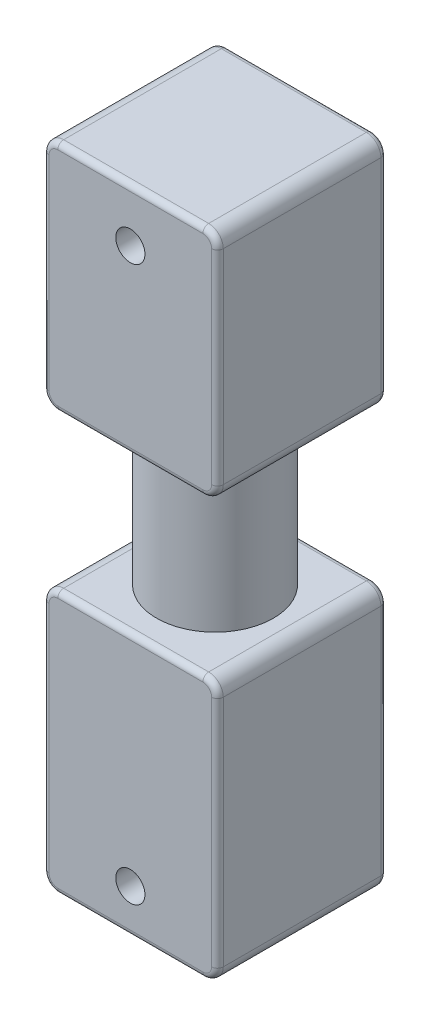
from build123d import *

# Parameters (mm, degrees)
BOSS_EXTRUDE1_DEPTH   = 29
BOSS_EXTRUDE1_2_DEPTH = 29
FILLET1_R             = 1
FILLET2_R             = 1
SKETCH3_R             = 10
BOSS_EXTRUDE2_DEPTH   = 26.527316462
SKETCH4_R             = 2.5
CUT_EXTRUDE4_DEPTH    = 112.4075373


with BuildPart() as part:
    # Sketch1 → Boss-Extrude1 (new body)
    with BuildSketch(Plane.XY):
        with BuildLine():
            Line((-12.418786495, 106.527316462), (12.418786495, 106.527316462))
            ThreePointArc((12.418786495, 106.527316462), (14.186553448, 105.795083415), (14.918786495, 104.027316462))
            Line((14.918786495, 104.027316462), (14.918786495, 69.027316462))
            ThreePointArc((14.918786495, 69.027316462), (14.186553448, 67.259549509), (12.418786495, 66.527316462))
            Line((12.418786495, 66.527316462), (7.418786495, 66.527316462))
            Line((7.418786495, 66.527316462), (-7.418786495, 66.527316462))
            Line((-7.418786495, 66.527316462), (-12.418786495, 66.527316462))
            ThreePointArc((-12.418786495, 66.527316462), (-14.186553448, 67.259549509), (-14.918786495, 69.027316462))
            Line((-14.918786495, 69.027316462), (-14.918786495, 104.027316462))
            ThreePointArc((-14.918786495, 104.027316462), (-14.186553448, 105.795083415), (-12.418786495, 106.527316462))
        make_face()
    extrude(amount=BOSS_EXTRUDE1_DEPTH)

    # Fillet2
    fillet2_edges = [part.edges().sort_by_distance(p)[0] for p in [
        (14.186553448, 105.795083415, 0),
        (0, 106.527316462, 0),
        (-14.186553448, 105.795083415, 0),
        (-14.918786495, 86.527316462, 0),
        (-14.186553448, 67.259549509, 0),
        (0, 66.527316462, 0),
        (14.186553448, 67.259549509, 0),
        (14.918786495, 86.527316462, 0),
        (14.186553448, 105.795083415, 29),
        (0, 106.527316462, 29),
        (-14.186553448, 105.795083415, 29),
        (-14.918786495, 86.527316462, 29),
        (-14.186553448, 67.259549509, 29),
        (0, 66.527316462, 29),
        (14.186553448, 67.259549509, 29),
        (14.918786495, 86.527316462, 29),
    ]]
    fillet(fillet2_edges, radius=FILLET2_R)



with BuildPart() as body_2:
    # Sketch1 → Boss-Extrude1 2 (new body)
    with BuildSketch(Plane.XY):
        with BuildLine():
            Line((7.418786495, 40), (12.418786495, 40))
            ThreePointArc((12.418786495, 40), (14.186553448, 39.267766953), (14.918786495, 37.5))
            Line((14.918786495, 37.5), (14.918786495, -2.5))
            ThreePointArc((14.918786495, -2.5), (14.186553448, -4.267766953), (12.418786495, -5))
            Line((12.418786495, -5), (-12.418786495, -5))
            ThreePointArc((-12.418786495, -5), (-14.186553448, -4.267766953), (-14.918786495, -2.5))
            Line((-14.918786495, -2.5), (-14.918786495, 37.5))
            ThreePointArc((-14.918786495, 37.5), (-14.186553448, 39.267766953), (-12.418786495, 40))
            Line((-12.418786495, 40), (-7.418786495, 40))
            Line((-7.418786495, 40), (7.418786495, 40))
        make_face()
    extrude(amount=BOSS_EXTRUDE1_2_DEPTH)

    # Fillet1
    fillet1_edges = [body_2.edges().sort_by_distance(p)[0] for p in [
        (-14.918786495, 17.5, 0),
        (-14.186553448, 39.267766953, 0),
        (0, 40, 0),
        (14.186553448, 39.267766953, 0),
        (14.918786495, 17.5, 0),
        (14.186553448, -4.267766953, 29),
        (14.186553448, -4.267766953, 0),
        (0, -5, 0),
        (-14.186553448, -4.267766953, 0),
        (14.918786495, 17.5, 29),
        (14.186553448, 39.267766953, 29),
        (0, 40, 29),
        (-14.186553448, 39.267766953, 29),
        (-14.918786495, 17.5, 29),
        (-14.186553448, -4.267766953, 29),
        (0, -5, 29),
    ]]
    fillet(fillet1_edges, radius=FILLET1_R)


with BuildPart() as part_1:
    add(part.part)

    add(body_2.part)  # Boss-Extrude2 merges body 2
    # Sketch3 → Boss-Extrude2 (add)
    with BuildSketch(Plane(origin=(0, 40, 0), x_dir=(1, 0, 0), z_dir=(0, 1, 0))):
        with Locations(Location((0, -14.5, 0), (0, 0, 90))):
            Circle(SKETCH3_R)
    extrude(amount=BOSS_EXTRUDE2_DEPTH)

    # Sketch4 → Cut-Extrude4 (cut, through all)
    with BuildSketch(Plane(origin=(0, 0, 0), x_dir=(-1, 0, 0), z_dir=(0, 0, -1))):
        with Locations((0, 97.5)):
            Circle(SKETCH4_R)
        with Locations((0, 2.5)):
            Circle(SKETCH4_R)
    extrude(amount=-CUT_EXTRUDE4_DEPTH, mode=Mode.SUBTRACT)


solid = part_1.part
